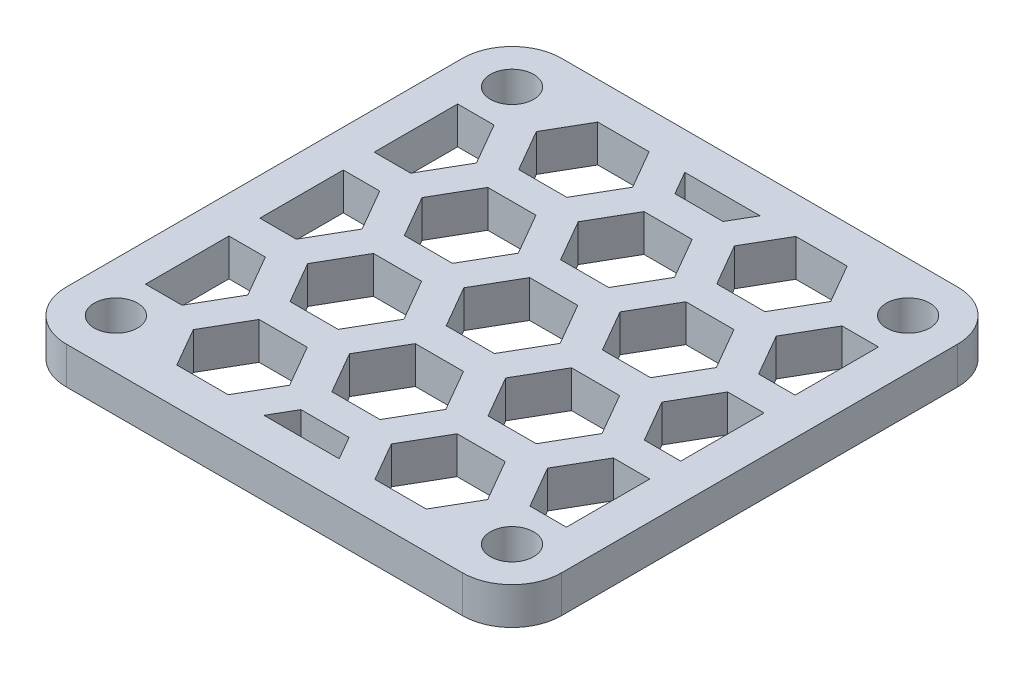
from build123d import *

# Parameters (mm, degrees)
SKETCH1_R           = 1.75
BOSS_EXTRUDE1_DEPTH = 3
CUT_EXTRUDE1_DEPTH  = 29.442925307
BOSS_EXTRUDE2_DEPTH = 3
SKETCH1_3_R         = 1.75
CUT_EXTRUDE2_DEPTH  = 29.442925307


with BuildPart() as part:
    # Sketch1 → Boss-Extrude1 (new body)
    # profile 1 of 5: a face of its own
    with BuildSketch(Plane(origin=(0, 0, 0), x_dir=(1, 0, 0), z_dir=(0, 1, 0))):
        with BuildLine():
            Line((-16, -20), (16, -20))
            ThreePointArc((16, -20), (18.828427125, -18.828427125), (20, -16))
            Line((20, -16), (20, 16))
            ThreePointArc((20, 16), (18.828427125, 18.828427125), (16, 20))
            Line((16, 20), (-16, 20))
            ThreePointArc((-16, 20), (-18.828427125, 18.828427125), (-20, 16))
            Line((-20, 16), (-20, -16))
            ThreePointArc((-20, -16), (-18.828427125, -18.828427125), (-16, -20))
        make_face()
        with Locations((-16, 16)):
            Circle(SKETCH1_R, mode=Mode.SUBTRACT)
        with Locations((16, 16)):
            Circle(SKETCH1_R, mode=Mode.SUBTRACT)
        with Locations((16, -16)):
            Circle(SKETCH1_R, mode=Mode.SUBTRACT)
        with Locations((-16, -16)):
            Circle(SKETCH1_R, mode=Mode.SUBTRACT)
    # profile 2 of 5: a face of its own
    with BuildSketch(Plane(origin=(0, 0, 0), x_dir=(1, 0, 0), z_dir=(0, 1, 0))):
        with Locations((-16, 16)):
            Circle(SKETCH1_R)
    # profile 3 of 5: a face of its own
    with BuildSketch(Plane(origin=(0, 0, 0), x_dir=(1, 0, 0), z_dir=(0, 1, 0))):
        with Locations((16, 16)):
            Circle(SKETCH1_R)
    # profile 4 of 5: a face of its own
    with BuildSketch(Plane(origin=(0, 0, 0), x_dir=(1, 0, 0), z_dir=(0, 1, 0))):
        with Locations((16, -16)):
            Circle(SKETCH1_R)
    # profile 5 of 5: a face of its own
    with BuildSketch(Plane(origin=(0, 0, 0), x_dir=(1, 0, 0), z_dir=(0, 1, 0))):
        with Locations((-16, -16)):
            Circle(SKETCH1_R)
    extrude(amount=BOSS_EXTRUDE1_DEPTH)

    # Sketch3 → Cut-Extrude1 (cut, through all)
    with BuildSketch(Plane(origin=(0, 0, 0), x_dir=(1, 0, 0), z_dir=(0, 1, 0))):
        Polygon((6.05502117, -1.25), (4.11004234, -4.618802154), (6.05502117, -7.987604307), (9.94497883, -7.987604307), (11.88995766, -4.618802154), (9.94497883, -1.25), align=None)
        Polygon((-1.94497883, 3.368802154), (-3.88995766, 0), (-1.94497883, -3.368802154), (1.94497883, -3.368802154), (3.88995766, 0), (1.94497883, 3.368802154), align=None)
        Polygon((14.05502117, 3.368802154), (12.11004234, 0), (14.05502117, -3.368802154), (17.94497883, -3.368802154), (19.88995766, 0), (17.94497883, 3.368802154), align=None)
        Polygon((22.05502117, -1.25), (20.11004234, -4.618802154), (22.05502117, -7.987604307), (25.94497883, -7.987604307), (27.88995766, -4.618802154), (25.94497883, -1.25), align=None)
        Polygon((14.05502117, 12.606402154), (12.11004234, 9.2376), (14.05502117, 5.868797846), (17.94497883, 5.868797846), (19.88995766, 9.2376), (17.94497883, 12.606402154), align=None)
        Polygon((22.05502117, 7.9876), (20.11004234, 4.618797846), (22.05502117, 1.249995693), (25.94497883, 1.249995693), (27.88995766, 4.618797846), (25.94497883, 7.9876), align=None)
        Polygon((14.05502117, 21.844002154), (12.11004234, 18.4752), (14.05502117, 15.106397846), (17.94497883, 15.106397846), (19.88995766, 18.4752), (17.94497883, 21.844002154), align=None)
        Polygon((22.05502117, 17.2252), (20.11004234, 13.856397846), (22.05502117, 10.487595693), (25.94497883, 10.487595693), (27.88995766, 13.856397846), (25.94497883, 17.2252), align=None)
        Polygon((-1.94497883, 12.606402154), (-3.88995766, 9.2376), (-1.94497883, 5.868797846), (1.94497883, 5.868797846), (3.88995766, 9.2376), (1.94497883, 12.606402154), align=None)
        Polygon((6.05502117, 7.9876), (4.11004234, 4.618797846), (6.05502117, 1.249995693), (9.94497883, 1.249995693), (11.88995766, 4.618797846), (9.94497883, 7.9876), align=None)
        Polygon((-1.94497883, 21.844002154), (-3.88995766, 18.4752), (-1.94497883, 15.106397846), (1.94497883, 15.106397846), (3.88995766, 18.4752), (1.94497883, 21.844002154), align=None)
        Polygon((6.05502117, 17.2252), (4.11004234, 13.856397846), (6.05502117, 10.487595693), (9.94497883, 10.487595693), (11.88995766, 13.856397846), (9.94497883, 17.2252), align=None)
        Polygon((-9.94497883, -1.25), (-6.05502117, -1.25), (-4.11004234, -4.618802154), (-6.05502117, -7.987604307), (-9.94497883, -7.987604307), (-11.88995766, -4.618802154), align=None)
        Polygon((-9.94497883, 7.9876), (-6.05502117, 7.9876), (-4.11004234, 4.618797846), (-6.05502117, 1.249995693), (-9.94497883, 1.249995693), (-11.88995766, 4.618797846), align=None)
        Polygon((-9.94497883, 17.2252), (-6.05502117, 17.2252), (-4.11004234, 13.856397846), (-6.05502117, 10.487595693), (-9.94497883, 10.487595693), (-11.88995766, 13.856397846), align=None)
        Polygon((-17.94497883, 12.606402154), (-14.05502117, 12.606402154), (-12.11004234, 9.2376), (-14.05502117, 5.868797846), (-17.94497883, 5.868797846), (-19.88995766, 9.2376), align=None)
        Polygon((-17.94497883, 3.368802154), (-14.05502117, 3.368802154), (-12.11004234, 0), (-14.05502117, -3.368802154), (-17.94497883, -3.368802154), (-19.88995766, 0), align=None)
        Polygon((-25.94497883, -1.25), (-22.05502117, -1.25), (-20.11004234, -4.618802154), (-22.05502117, -7.987604307), (-25.94497883, -7.987604307), (-27.88995766, -4.618802154), align=None)
        Polygon((-25.94497883, 7.9876), (-22.05502117, 7.9876), (-20.11004234, 4.618797846), (-22.05502117, 1.249995693), (-25.94497883, 1.249995693), (-27.88995766, 4.618797846), align=None)
        Polygon((-25.94497883, 17.2252), (-22.05502117, 17.2252), (-20.11004234, 13.856397846), (-22.05502117, 10.487595693), (-25.94497883, 10.487595693), (-27.88995766, 13.856397846), align=None)
        Polygon((-17.94497883, 21.844002154), (-14.05502117, 21.844002154), (-12.11004234, 18.4752), (-14.05502117, 15.106397846), (-17.94497883, 15.106397846), (-19.88995766, 18.4752), align=None)
        Polygon((17.94497883, -21.844002154), (14.05502117, -21.844002154), (12.11004234, -18.4752), (14.05502117, -15.106397846), (17.94497883, -15.106397846), (19.88995766, -18.4752), align=None)
        Polygon((25.94497883, -17.2252), (22.05502117, -17.2252), (20.11004234, -13.856397846), (22.05502117, -10.487595693), (25.94497883, -10.487595693), (27.88995766, -13.856397846), align=None)
        Polygon((17.94497883, -12.606402154), (14.05502117, -12.606402154), (12.11004234, -9.2376), (14.05502117, -5.868797846), (17.94497883, -5.868797846), (19.88995766, -9.2376), align=None)
        Polygon((9.94497883, -17.2252), (6.05502117, -17.2252), (4.11004234, -13.856397846), (6.05502117, -10.487595693), (9.94497883, -10.487595693), (11.88995766, -13.856397846), align=None)
        Polygon((1.94497883, -21.844002154), (-1.94497883, -21.844002154), (-3.88995766, -18.4752), (-1.94497883, -15.106397846), (1.94497883, -15.106397846), (3.88995766, -18.4752), align=None)
        Polygon((1.94497883, -12.606402154), (-1.94497883, -12.606402154), (-3.88995766, -9.2376), (-1.94497883, -5.868797846), (1.94497883, -5.868797846), (3.88995766, -9.2376), align=None)
        Polygon((-11.88995766, -13.856397846), (-9.94497883, -17.2252), (-6.05502117, -17.2252), (-4.11004234, -13.856397846), (-6.05502117, -10.487595693), (-9.94497883, -10.487595693), align=None)
        Polygon((-19.88995766, -18.4752), (-17.94497883, -21.844002154), (-14.05502117, -21.844002154), (-12.11004234, -18.4752), (-14.05502117, -15.106397846), (-17.94497883, -15.106397846), align=None)
        Polygon((-27.88995766, -13.856397846), (-25.94497883, -17.2252), (-22.05502117, -17.2252), (-20.11004234, -13.856397846), (-22.05502117, -10.487595693), (-25.94497883, -10.487595693), align=None)
        Polygon((-19.88995766, -9.2376), (-17.94497883, -12.606402154), (-14.05502117, -12.606402154), (-12.11004234, -9.2376), (-14.05502117, -5.868797846), (-17.94497883, -5.868797846), align=None)
    extrude(amount=CUT_EXTRUDE1_DEPTH, mode=Mode.SUBTRACT)

    # Sketch4 → Boss-Extrude2 (add, through all)
    with BuildSketch(Plane(origin=(0, 0, 0), x_dir=(1, 0, 0), z_dir=(0, 1, 0))):
        with BuildLine():
            Line((-20, 16), (-20, -16))
            ThreePointArc((-20, -16), (-18.828427125, -18.828427125), (-16, -20))
            Line((-16, -20), (16, -20))
            ThreePointArc((16, -20), (18.828427125, -18.828427125), (20, -16))
            Line((20, -16), (20, 16))
            ThreePointArc((20, 16), (18.828427125, 18.828427125), (16, 20))
            Line((16, 20), (-16, 20))
            ThreePointArc((-16, 20), (-18.828427125, 18.828427125), (-20, 16))
        make_face()
        Polygon((12.961749457, 17), (-12.961749457, 17), (-14.05502117, 15.106397846), (-17, 15.106397846), (-17, -15.106397846), (-14.05502117, -15.106397846), (-12.961749457, -17), (12.961749457, -17), (14.05502117, -15.106397846), (17, -15.106397846), (17, 15.106397846), (14.05502117, 15.106397846), align=None, mode=Mode.SUBTRACT)
    extrude(amount=BOSS_EXTRUDE2_DEPTH)

    # Sketch1<3> → Cut-Extrude2 (cut, through all)
    with BuildSketch(Plane(origin=(0, 0, 0), x_dir=(1, 0, 0), z_dir=(0, 1, 0))):
        with Locations(Location((16, 16, 0), (0, 0, 270))):
            Circle(SKETCH1_3_R)
        with Locations(Location((-16, -16, 0), (0, 0, 270))):
            Circle(SKETCH1_3_R)
        with Locations(Location((16, -16, 0), (0, 0, 270))):
            Circle(SKETCH1_3_R)
        with Locations(Location((-16, 16, 0), (0, 0, 270))):
            Circle(SKETCH1_3_R)
    extrude(amount=CUT_EXTRUDE2_DEPTH, mode=Mode.SUBTRACT)


solid = part.part
